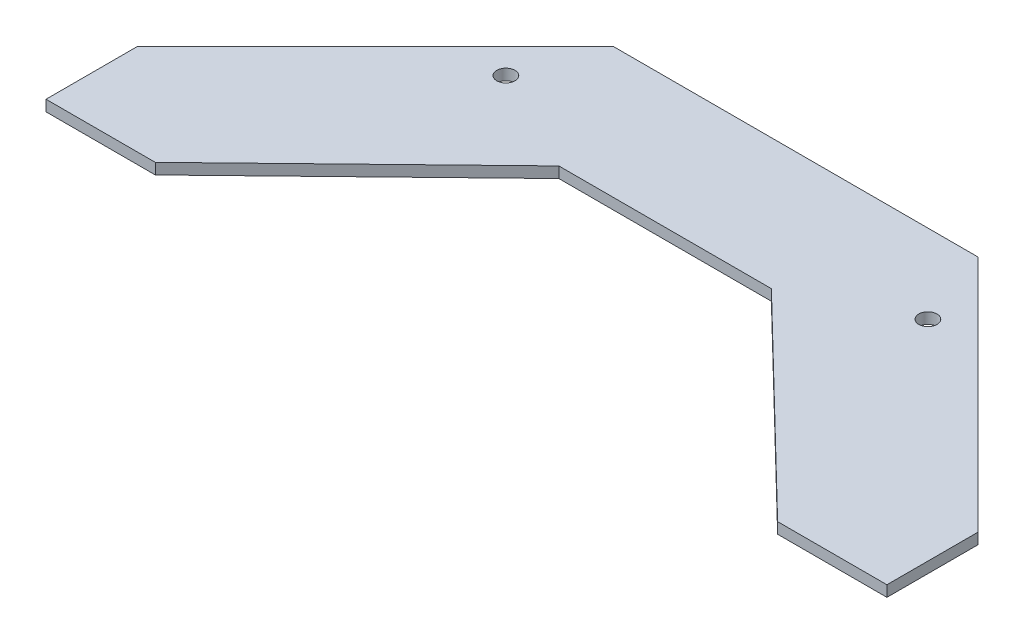
from build123d import *

# Parameters (mm, degrees)
BOSS_EXTRUDE1_DEPTH = 1.8
SKETCH2_R           = 1.5
CUT_EXTRUDE2_DEPTH  = 1.8


with BuildPart() as part:
    # Sketch1 → Boss-Extrude1 (new body)
    with BuildSketch(Plane(origin=(0, 0, 0), x_dir=(1, 0, 0), z_dir=(0, 1, 0))):
        Polygon((0, 0), (60, 0), (99.244426356, -39.244426356), (99.244426356, -54.244426356), (81.244426356, -54.244426356), (47.5, -21.528777349), (12.5, -21.528777349), (-21.244426356, -54.244426356), (-39.244426356, -54.244426356), (-39.244426356, -39.244426356), align=None)
    extrude(amount=BOSS_EXTRUDE1_DEPTH)

    # Sketch2 → Cut-Extrude2 (cut)
    with BuildSketch(Plane(origin=(0, 1.8, 0), x_dir=(1, 0, 0), z_dir=(0, 1, 0))):
        with Locations(Location((-4.75, -13, 0), (0, 0, 270))):
            Circle(SKETCH2_R)
        with Locations(Location((64.75, -13, 0), (0, 0, 270))):
            Circle(SKETCH2_R)
    extrude(amount=-CUT_EXTRUDE2_DEPTH, mode=Mode.SUBTRACT)


solid = part.part
